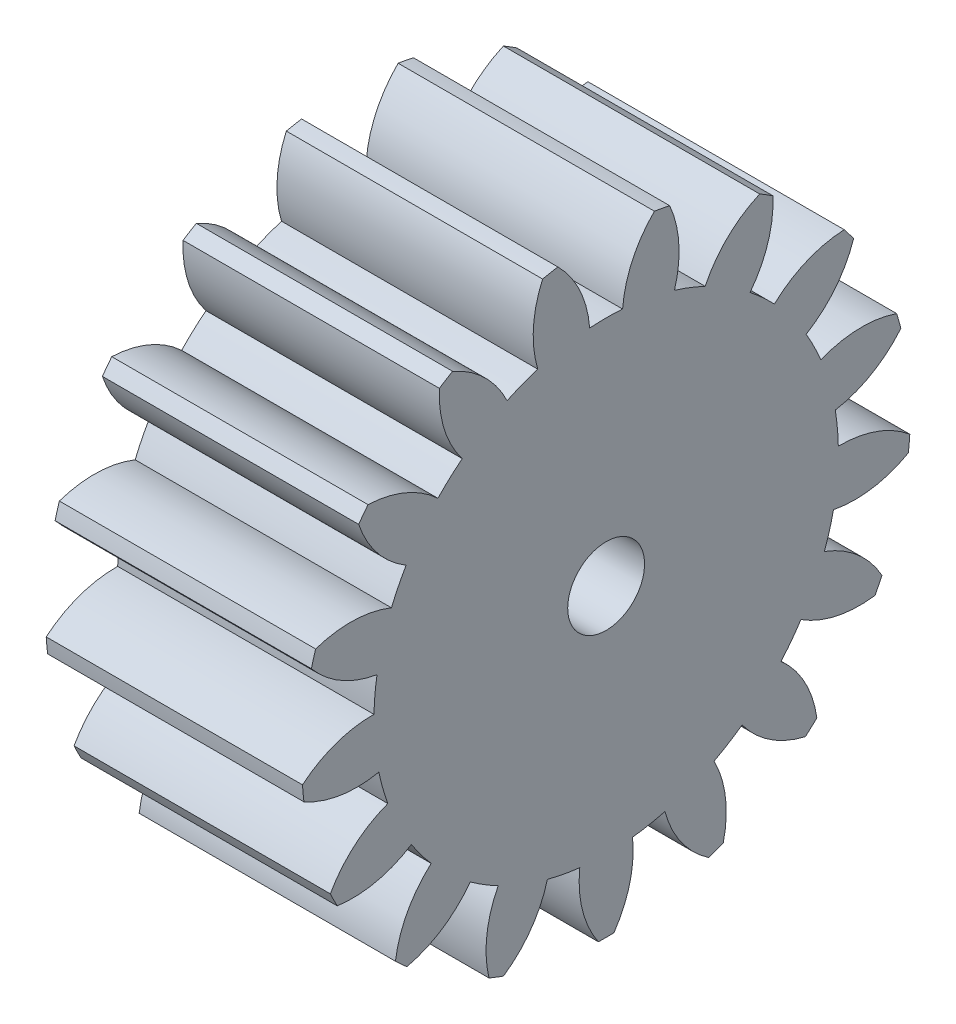
from build123d import *

# Parameters (mm, degrees)
BASPROSKE_W     = 10
BASPROSKE_H     = 11.875
TOOTHCUT_DEPTH  = 20.545619714
TEETHCUTS_COUNT = 17
TEETHCUTS_ANGLE = 338.823529412
BORSKE_R        = 1.5
BORE_DEPTH      = 50.0000508


with BuildPart() as part:
    # BasProSke → Base-Revolve (revolve)
    with BuildSketch(Plane(origin=(0, 0, 0), x_dir=(1, 0, 0), z_dir=(0, 1, 0)), mode=Mode.PRIVATE) as base_revolve_sk:
        with Locations((5, 5.9375)):
            Rectangle(BASPROSKE_W, BASPROSKE_H)
    revolve(base_revolve_sk.sketch.rotate(Axis((-10, 0, 0), (1, 0, 0)), 180), axis=Axis((-10, 0, 0), (1, 0, 0)))

    # TooCutSke → ToothCut (cut, through all)
    with BuildSketch(Plane(origin=(0, 0, 0), x_dir=(0, 0, -1), z_dir=(1, 0, 0))):
        with BuildLine():
            ThreePointArc((0.642360767, 9.038703164), (0, 9.0615), (-0.642360767, 9.038703164))
            ThreePointArc((-0.642360767, 9.038703164), (-1.028230329, 10.507462755), (-1.905837205, 11.746799764))
            ThreePointArc((-1.905837205, 11.746799764), (0, 11.9004), (1.905837205, 11.746799764))
            ThreePointArc((1.905837205, 11.746799764), (1.028230329, 10.507462755), (0.642360767, 9.038703164))
        make_face()
    toothcut = extrude(amount=TOOTHCUT_DEPTH, mode=Mode.SUBTRACT)

    # TeethCuts: ToothCut ×17 about axis
    teethcuts_axis = Axis((-10, 0, 0), (1, 0, 0))
    for i in range(1, TEETHCUTS_COUNT):
        add(toothcut.rotate(teethcuts_axis, i * TEETHCUTS_ANGLE / (TEETHCUTS_COUNT - 1)), mode=Mode.SUBTRACT)

    # BorSke → Bore (cut, symmetric)
    with BuildSketch(Plane(origin=(0, 0, 0), x_dir=(0, 0, -1), z_dir=(1, 0, 0))):
        with Locations(Location((0, 0, 0), (0, 0, 180))):
            Circle(BORSKE_R)
    extrude(amount=BORE_DEPTH, both=True, mode=Mode.SUBTRACT)


solid = part.part
